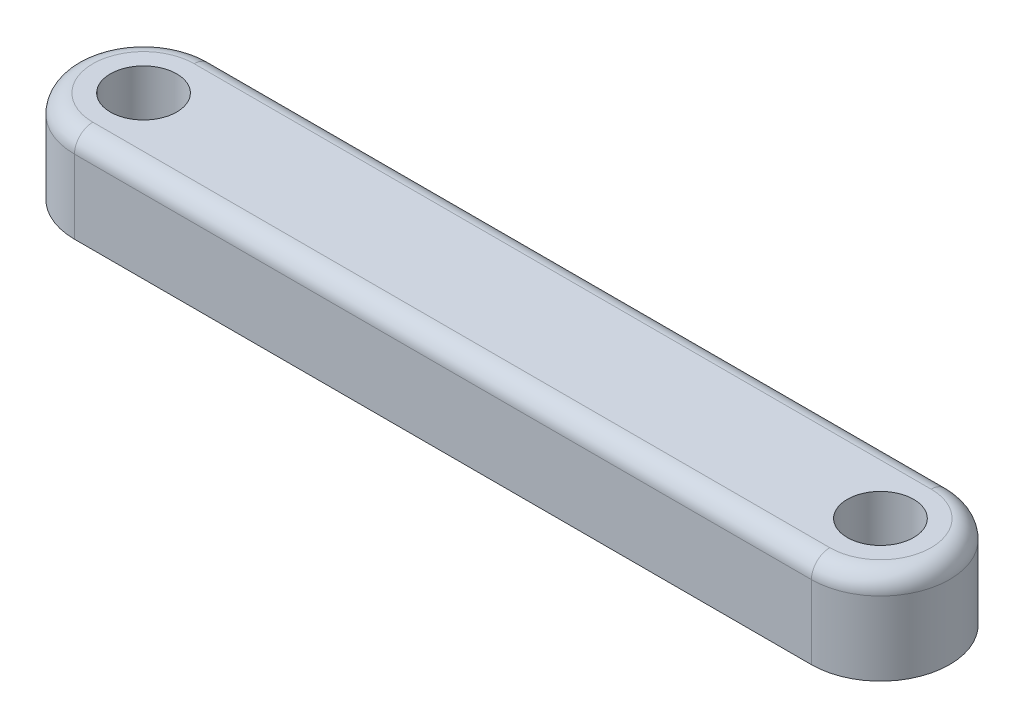
from build123d import *

# Parameters (mm, degrees)
SKETCH1_R           = 2.286
BOSS_EXTRUDE1_DEPTH = 6.35
FILLET1_R           = 1.27


with BuildPart() as part:
    # Sketch1 → Boss-Extrude1 (new body)
    with BuildSketch(Plane(origin=(0, 0, 0), x_dir=(1, 0, 0), z_dir=(0, 1, 0))):
        with BuildLine():
            Line((0, -4.7625), (-50.8, -4.7625))
            ThreePointArc((-50.8, -4.7625), (-55.5625, 0), (-50.8, 4.7625))
            Line((-50.8, 4.7625), (0, 4.7625))
            ThreePointArc((0, 4.7625), (4.7625, 0), (0, -4.7625))
        make_face()
        with Locations(Location((-50.8, 0, 0), (0, 0, 270))):
            Circle(SKETCH1_R, mode=Mode.SUBTRACT)
        with Locations(Location((0, 0, 0), (0, 0, 270))):
            Circle(SKETCH1_R, mode=Mode.SUBTRACT)
    extrude(amount=BOSS_EXTRUDE1_DEPTH)

    # Fillet1
    fillet1_edges = [part.edges().sort_by_distance(p)[0] for p in [
        (-55.5625, 6.35, 0),
        (-25.4, 6.35, 4.7625),
        (4.7625, 6.35, 0),
        (-25.4, 6.35, -4.7625),
    ]]
    fillet(fillet1_edges, radius=FILLET1_R)


solid = part.part
